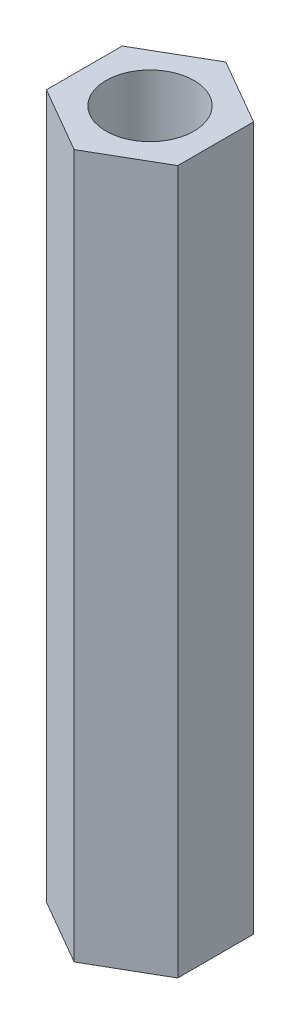
from build123d import *

# Parameters (mm, degrees)
SKETCH1_R           = 1.190625
BOSS_EXTRUDE1_DEPTH = 19.05


with BuildPart() as part:
    # Sketch1 → Boss-Extrude1 (new body)
    with BuildSketch(Plane(origin=(0, 0, 0), x_dir=(1, 0, 0), z_dir=(0, 1, 0))):
        Polygon((0, -2.053057557), (1.778, -1.026528779), (1.778, 1.026528779), (0, 2.053057557), (-1.778, 1.026528779), (-1.778, -1.026528779), align=None)
        with Locations(Location((0, 0, 0), (0, 0, 90))):
            Circle(SKETCH1_R, mode=Mode.SUBTRACT)
    extrude(amount=BOSS_EXTRUDE1_DEPTH)


solid = part.part
